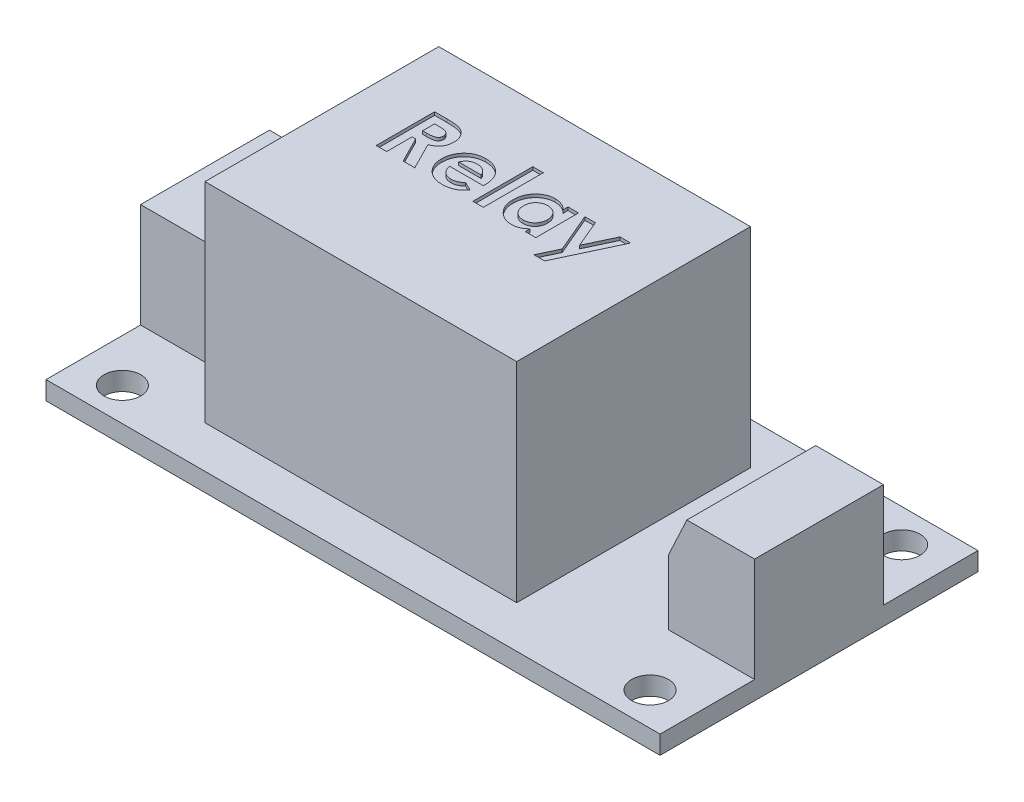
from build123d import *
from OCP.BRepFilletAPI import BRepFilletAPI_MakeChamfer

# Parameters (mm, degrees)
SKETCH1_W           = 50.038
SKETCH1_H           = 25.908
BOSS_EXTRUDE1_DEPTH = 1.5
SKETCH2_W           = 25.4
SKETCH2_H           = 19.05
BOSS_EXTRUDE2_DEPTH = 17.018
SKETCH3_W           = 6.99999997
SKETCH3_H           = 10.5
BOSS_EXTRUDE3_DEPTH = 8.5
CHAMFER1_SIZE       = 3.175
CHAMFER1_SIZE2      = 1.480526815
SKETCH4_W           = 0.854807692
SKETCH4_H           = 4.884615385
CUT_EXTRUDE1_DEPTH  = 0.254
SKETCH6_R           = 1.5
CUT_EXTRUDE2_DEPTH  = 34.714578519


with BuildPart() as part:
    # Sketch1 → Boss-Extrude1 (new body)
    with BuildSketch(Plane(origin=(0, 0, 0), x_dir=(1, 0, 0), z_dir=(0, 1, 0))):
        Rectangle(SKETCH1_W, SKETCH1_H)
    extrude(amount=BOSS_EXTRUDE1_DEPTH)

    # Sketch2 → Boss-Extrude2 (add)
    with BuildSketch(Plane(origin=(0, 1.5, 0), x_dir=(1, 0, 0), z_dir=(0, 1, 0))):
        with Locations((-2.794, 0)):
            Rectangle(SKETCH2_W, SKETCH2_H)
    extrude(amount=BOSS_EXTRUDE2_DEPTH)

    # Sketch3 → Boss-Extrude3 (add)
    with BuildSketch(Plane(origin=(0, 1.5, 0), x_dir=(1, 0, 0), z_dir=(0, 1, 0))):
        with Locations((-21.519000015, 0)):
            Rectangle(SKETCH3_W, SKETCH3_H)
        with Locations((21.519000015, 0)):
            Rectangle(SKETCH3_W, SKETCH3_H)
    extrude(amount=BOSS_EXTRUDE3_DEPTH)

    # Chamfer1: one chamfer whose edges measure the first distance from different faces: ONE call of the kernel's chamfer builder (chamfer() names one face for all edges)
    chamfer1_edges_1 = [part.edges().sort_by_distance(p)[0] for p in [
        (-18.01900003, 10, 0),
    ]]
    chamfer1_side_1 = [part.faces().sort_by_distance(p)[0] for p in [
        (-18.01900003, 5.75, 0),
    ]]
    chamfer1_edges_2 = [part.edges().sort_by_distance(p)[0] for p in [
        (18.01900003, 10, 0),
    ]]
    chamfer1_side_2 = [part.faces().sort_by_distance(p)[0] for p in [
        (18.01900003, 5.75, 0),
    ]]
    chamfer1 = BRepFilletAPI_MakeChamfer(part.part.solid().wrapped)
    for e in chamfer1_edges_1:
        chamfer1.Add(CHAMFER1_SIZE, CHAMFER1_SIZE2, e.wrapped, chamfer1_side_1[0].wrapped)  # the first distance lies on this face
    for e in chamfer1_edges_2:
        chamfer1.Add(CHAMFER1_SIZE, CHAMFER1_SIZE2, e.wrapped, chamfer1_side_2[0].wrapped)  # the first distance lies on this face
    add(Compound.cast(chamfer1.Shape()), mode=Mode.REPLACE)

    # Sketch4 → Cut-Extrude1 (cut)
    # profile 1 of 5: a face of its own
    with BuildSketch(Plane(origin=(0, 18.518, 0), x_dir=(1, 0, 0), z_dir=(0, 1, 0))):
        with BuildLine():
            Line((-11.067317308, 4.7625), (-10.071313702, 4.7625))
            add(Edge.make_bspline(
                [(-10.071313702, 4.7625), (-10.005478167, 4.762266322), (-9.878857888, 4.761816892), (-9.696278361, 4.754726088), (-9.528553957, 4.744858652), (-9.375436345, 4.729800683), (-9.236991031, 4.709835636), (-9.113079259, 4.686300149), (-9.003704652, 4.659476416), (-8.907944787, 4.626051928), (-8.821526244, 4.588349612), (-8.740972147, 4.545028961), (-8.664505354, 4.496572362), (-8.592636962, 4.441704791), (-8.524742417, 4.381413304), (-8.460693634, 4.315637209), (-8.40139568, 4.243818754), (-8.347215731, 4.166411739), (-8.297835069, 4.084981335), (-8.25419292, 3.999415736), (-8.218703053, 3.909655438), (-8.18734395, 3.816997671), (-8.164757004, 3.720117874), (-8.149048114, 3.619959188), (-8.137546679, 3.516169044), (-8.136885402, 3.445658629), (-8.136548077, 3.409690505)],
                knots=[0, 0, 0, 0, 1.749336639, 3.364467119, 4.854658419, 6.213483162, 7.451590619, 8.570285859, 9.5643256, 10.440900261, 11.26203566, 12.067320669, 12.869050712, 13.665104639, 14.467235401, 15.27997916, 16.102287765, 16.939272006, 17.78853747, 18.631303466, 19.488103222, 20.351255419, 21.228522269, 22.127379805, 23.044756219, 24, 24, 24, 24], degree=3))
            add(Edge.make_bspline(
                [(-8.136548077, 3.409690505), (-8.137424325, 3.372148046), (-8.139142489, 3.298534126), (-8.148397453, 3.190401282), (-8.165312621, 3.08694734), (-8.190933103, 2.988475202), (-8.220380519, 2.893759265), (-8.259538028, 2.804547099), (-8.303731148, 2.719541242), (-8.356218026, 2.639944134), (-8.413819809, 2.563987763), (-8.480809472, 2.494582302), (-8.552847113, 2.427997468), (-8.633982229, 2.368403909), (-8.720638311, 2.311772125), (-8.814537122, 2.260448648), (-8.915065847, 2.213143322), (-8.98574252, 2.186762605), (-9.021884615, 2.173272236)],
                knots=[0, 0, 0, 0, 1.099860209, 2.156625411, 3.176576793, 4.16617041, 5.135385252, 6.078461593, 7.016046972, 7.938469504, 8.868247731, 9.803980173, 10.76021508, 11.73834243, 12.748633912, 13.790971185, 14.870363756, 16, 16, 16, 16], degree=3))
            Line((-9.021884615, 2.173272236), (-7.922846154, 0))
            Line((-7.922846154, 0), (-8.87305649, 0))
            Line((-8.87305649, 0), (-9.922485577, 2.075961538))
            Line((-9.922485577, 2.075961538), (-10.212509615, 2.075961538))
            Line((-10.212509615, 2.075961538), (-10.212509615, 0))
            Line((-10.212509615, 0), (-11.067317308, 0))
            Line((-11.067317308, 0), (-11.067317308, 4.7625))
        make_face()
        with BuildLine():
            Line((-10.212509615, 2.930769231), (-9.879554387, 2.930769231))
            add(Edge.make_bspline(
                [(-9.879554387, 2.930769231), (-9.838847843, 2.931227695), (-9.760903557, 2.932105556), (-9.648809437, 2.936177439), (-9.547001243, 2.945988665), (-9.455041776, 2.958384782), (-9.372468305, 2.972697889), (-9.300017355, 2.993209441), (-9.236572569, 3.015188087), (-9.182885769, 3.042501844), (-9.137017001, 3.07356351), (-9.097412256, 3.108850334), (-9.064653453, 3.14969034), (-9.037691287, 3.194973672), (-9.016717653, 3.24510085), (-9.001408507, 3.299521593), (-8.992852959, 3.358855821), (-8.991868614, 3.399804517), (-8.991355769, 3.421138822)],
                knots=[0, 0, 0, 0, 1.688639943, 3.233382647, 4.650958383, 5.928841754, 7.082724185, 8.122798841, 9.049171256, 9.863274652, 10.613301712, 11.341792392, 12.054588806, 12.776240173, 13.521029143, 14.301969904, 15.115324896, 16, 16, 16, 16], degree=3))
            add(Edge.make_bspline(
                [(-8.991355769, 3.421138822), (-8.992325349, 3.446378863), (-8.994229908, 3.495958245), (-9.013129056, 3.567335171), (-9.043212417, 3.633399399), (-9.084448465, 3.693852436), (-9.136379907, 3.746849741), (-9.195975333, 3.793567287), (-9.264520958, 3.830508027), (-9.327989048, 3.854873746), (-9.385730175, 3.869452007), (-9.43783972, 3.880315598), (-9.498182887, 3.888014937), (-9.566805232, 3.896181456), (-9.643531834, 3.90147703), (-9.728780899, 3.905341744), (-9.822307592, 3.906922988), (-9.88750458, 3.907428484), (-9.92153155, 3.907692308)],
                knots=[0, 0, 0, 0, 1.020303359, 2.004196876, 2.966617323, 3.9489082, 4.950758222, 5.960522915, 7.003732012, 8.091992268, 8.70421221, 9.413913587, 10.24622431, 11.166358409, 12.212345909, 13.359657661, 14.621978493, 16, 16, 16, 16], degree=3))
            Line((-9.92153155, 3.907692308), (-10.212509615, 3.907692308))
            Line((-10.212509615, 3.907692308), (-10.212509615, 2.930769231))
        make_face(mode=Mode.SUBTRACT)
    # profile 2 of 5: a face of its own
    with BuildSketch(Plane(origin=(0, 18.518, 0), x_dir=(1, 0, 0), z_dir=(0, 1, 0))):
        with BuildLine():
            Line((-3.865371695, 1.526442308), (-6.610105769, 1.526442308))
            add(Edge.make_bspline(
                [(-6.610105769, 1.526442308), (-6.604509478, 1.494550055), (-6.593512324, 1.431879262), (-6.569631614, 1.340844497), (-6.539156247, 1.255054871), (-6.502633438, 1.174395705), (-6.460678962, 1.098440584), (-6.411742542, 1.027545769), (-6.356444891, 0.961773878), (-6.295105726, 0.901410762), (-6.228747459, 0.847324102), (-6.157691904, 0.799940769), (-6.081865735, 0.761089335), (-6.002138271, 0.728341607), (-5.917913765, 0.702402089), (-5.829068258, 0.684512097), (-5.735837268, 0.673944413), (-5.672325469, 0.672415918), (-5.639860877, 0.671634615)],
                knots=[0, 0, 0, 0, 1.091296461, 2.144483647, 3.168565212, 4.157007626, 5.126487748, 6.090021542, 7.05641414, 8.019231907, 8.98705074, 9.938580405, 10.892824166, 11.854447369, 12.841318655, 13.858982407, 14.905600794, 16, 16, 16, 16], degree=3))
            add(Edge.make_bspline(
                [(-5.639860877, 0.671634615), (-5.600673911, 0.672669189), (-5.523503235, 0.67470657), (-5.410447619, 0.692775108), (-5.30110637, 0.720066841), (-5.196514241, 0.760651938), (-5.095459697, 0.81117325), (-4.999606405, 0.874116589), (-4.907295221, 0.947642543), (-4.850974521, 1.004316321), (-4.822260216, 1.033210637)],
                knots=[0, 0, 0, 0, 1.021034703, 2.010718019, 2.977989445, 3.954245119, 4.929443971, 5.918328161, 6.938689359, 8, 8, 8, 8], degree=3))
            Line((-4.822260216, 1.033210637), (-4.106740385, 0.692623197))
            add(Edge.make_bspline(
                [(-4.106740385, 0.692623197), (-4.129268109, 0.66149334), (-4.173905966, 0.599810672), (-4.24677577, 0.513007227), (-4.322820051, 0.432016092), (-4.402095521, 0.357369958), (-4.484702723, 0.289281535), (-4.570411864, 0.226921385), (-4.660475546, 0.171963853), (-4.753092963, 0.121750125), (-4.850178689, 0.078702129), (-4.951464044, 0.041992318), (-5.056520029, 0.008806961), (-5.166673272, -0.016478463), (-5.28100653, -0.036494199), (-5.399793309, -0.050708023), (-5.523017955, -0.059487221), (-5.606773028, -0.060527984), (-5.649401142, -0.061057692)],
                knots=[0, 0, 0, 0, 1.028154879, 2.037251081, 3.030720504, 4.000128189, 4.949298328, 5.894184978, 6.834267904, 7.770992897, 8.712077017, 9.673380525, 10.653304757, 11.658697181, 12.695551717, 13.758623199, 14.859225354, 16, 16, 16, 16], degree=3))
            add(Edge.make_bspline(
                [(-5.649401142, -0.061057692), (-5.714983794, -0.059720659), (-5.843423639, -0.057102157), (-6.031290131, -0.032798711), (-6.209711191, 0.007499023), (-6.379190619, 0.062277602), (-6.538995812, 0.134602488), (-6.689205857, 0.223061824), (-6.831321568, 0.325959665), (-6.961000516, 0.445455566), (-7.079141864, 0.575519749), (-7.182909878, 0.715199801), (-7.269741475, 0.863519828), (-7.341049328, 1.019498219), (-7.396472269, 1.183534217), (-7.436428995, 1.355699403), (-7.460922946, 1.535911549), (-7.463568415, 1.658656137), (-7.464913462, 1.721063702)],
                knots=[0, 0, 0, 0, 1.103565453, 2.161269334, 3.182010356, 4.179077853, 5.15417608, 6.128274628, 7.109042802, 8.101804412, 9.090965879, 10.063106201, 11.02526161, 11.978650795, 12.945248442, 13.93468508, 14.949922959, 16, 16, 16, 16], degree=3))
            add(Edge.make_bspline(
                [(-7.464913462, 1.721063702), (-7.463555176, 1.785057123), (-7.460882812, 1.910961304), (-7.436639887, 2.095334631), (-7.396361802, 2.271251722), (-7.340776737, 2.438954834), (-7.270550632, 2.598968471), (-7.182614253, 2.749892704), (-7.079193358, 2.892252971), (-6.961477612, 3.025383294), (-6.831249304, 3.145547956), (-6.692869423, 3.252638683), (-6.544783129, 3.341873786), (-6.388665406, 3.413975693), (-6.225514839, 3.472556673), (-6.053445636, 3.511537423), (-5.87376698, 3.537710663), (-5.750942608, 3.540121055), (-5.688516226, 3.541346154)],
                knots=[0, 0, 0, 0, 1.079208495, 2.12329425, 3.130605359, 4.119693003, 5.099659317, 6.073216462, 7.060498243, 8.06384408, 9.066070512, 10.045757761, 11.010926815, 11.975797609, 12.942977511, 13.929384301, 14.947594487, 16, 16, 16, 16], degree=3))
            add(Edge.make_bspline(
                [(-5.688516226, 3.541346154), (-5.622619388, 3.539988378), (-5.493237738, 3.537322524), (-5.304062814, 3.513216417), (-5.124457059, 3.472672952), (-4.953655253, 3.418368033), (-4.793838603, 3.344216144), (-4.641495455, 3.257933653), (-4.50027986, 3.152811596), (-4.36868661, 3.03390047), (-4.249896808, 2.901972697), (-4.146061359, 2.758658728), (-4.057710172, 2.605357225), (-3.986100658, 2.441446516), (-3.930734626, 2.267418679), (-3.890740914, 2.083499721), (-3.866433793, 1.888990104), (-3.86383755, 1.755798222), (-3.862509615, 1.687672776)],
                knots=[0, 0, 0, 0, 1.080001299, 2.120471247, 3.119684163, 4.095710327, 5.052285597, 6.002875087, 6.961153713, 7.931888285, 8.906493152, 9.865905668, 10.82813294, 11.801621613, 12.7925306, 13.817193356, 14.883530496, 16, 16, 16, 16], degree=3))
            Line((-3.862509615, 1.687672776), (-3.865371695, 1.526442308))
        make_face()
        with BuildLine():
            add(Edge.make_bspline(
                [(-4.717317308, 2.198076923), (-4.733448052, 2.241607267), (-4.765520173, 2.32815693), (-4.837969759, 2.447574346), (-4.934108043, 2.550994679), (-5.045923764, 2.64255352), (-5.173680226, 2.716868394), (-5.3133516, 2.770674777), (-5.463172467, 2.802937758), (-5.56624115, 2.806721639), (-5.618872296, 2.808653846)],
                knots=[0, 0, 0, 0, 0.954238005, 1.897273737, 2.851915805, 3.847685534, 4.862635127, 5.880135777, 6.917509367, 8, 8, 8, 8], degree=3))
            add(Edge.make_bspline(
                [(-5.618872296, 2.808653846), (-5.676354076, 2.806797726), (-5.788718989, 2.803169399), (-5.950797725, 2.764580803), (-6.103682541, 2.706988476), (-6.193814763, 2.647609565), (-6.238989483, 2.617848558)],
                knots=[0, 0, 0, 0, 1.044195649, 2.041185066, 3.018232172, 4, 4, 4, 4], degree=3))
            add(Edge.make_bspline(
                [(-6.238989483, 2.617848558), (-6.267175135, 2.595181923), (-6.327265503, 2.546857816), (-6.405305036, 2.450455811), (-6.482174627, 2.333734623), (-6.525879227, 2.245076635), (-6.549048077, 2.198076923)],
                knots=[0, 0, 0, 0, 0.82159062, 1.751589201, 2.808063854, 4, 4, 4, 4], degree=3))
            Line((-6.549048077, 2.198076923), (-4.717317308, 2.198076923))
        make_face(mode=Mode.SUBTRACT)
    # profile 3 of 5: a face of its own
    with BuildSketch(Plane(origin=(0, 18.518, 0), x_dir=(1, 0, 0), z_dir=(0, 1, 0))):
        with Locations((-2.763471154, 2.442307693)):
            Rectangle(SKETCH4_W, SKETCH4_H)
    # profile 4 of 5: a face of its own
    with BuildSketch(Plane(origin=(0, 18.518, 0), x_dir=(1, 0, 0), z_dir=(0, 1, 0))):
        with BuildLine():
            Line((1.083163462, 3.480288462), (1.937971154, 3.480288462))
            Line((1.937971154, 3.480288462), (1.937971154, 0))
            Line((1.937971154, 0), (1.083163462, 0))
            Line((1.083163462, 0), (1.083163462, 0.379702524))
            add(Edge.make_bspline(
                [(1.083163462, 0.379702524), (1.040808055, 0.342742686), (0.958604576, 0.271010939), (0.829078493, 0.177937173), (0.699173919, 0.101163345), (0.56826666, 0.040017178), (0.434344726, -0.005132973), (0.296443933, -0.037822737), (0.152578363, -0.057100691), (0.05478053, -0.059724952), (0.005113582, -0.061057692)],
                knots=[0, 0, 0, 0, 1.129196829, 2.191548051, 3.199897424, 4.157751732, 5.089409408, 6.034969131, 7.002052659, 8, 8, 8, 8], degree=3))
            add(Edge.make_bspline(
                [(0.005113582, -0.061057692), (-0.050639776, -0.059803416), (-0.16081157, -0.057324895), (-0.322476448, -0.031234465), (-0.478579959, 0.008702754), (-0.628995391, 0.06521891), (-0.773449078, 0.138452769), (-0.913046527, 0.226493557), (-1.045394614, 0.332432032), (-1.171595091, 0.451684506), (-1.28714349, 0.582863076), (-1.388156991, 0.724147001), (-1.473303866, 0.873532482), (-1.543060144, 1.030524235), (-1.597932464, 1.195007039), (-1.637048577, 1.367502582), (-1.660127129, 1.548072471), (-1.662983603, 1.671069608), (-1.664432692, 1.733466046)],
                knots=[0, 0, 0, 0, 0.980476535, 1.937477201, 2.874147792, 3.812856188, 4.758993464, 5.720109578, 6.712210464, 7.737600662, 8.772720504, 9.783789959, 10.789002326, 11.793715968, 12.802552247, 13.835794126, 14.902098527, 16, 16, 16, 16], degree=3))
            add(Edge.make_bspline(
                [(-1.664432692, 1.733466046), (-1.662911868, 1.798077639), (-1.659928601, 1.92482048), (-1.638106182, 2.110809571), (-1.599711909, 2.287582127), (-1.547358557, 2.455383002), (-1.480015061, 2.614241187), (-1.397995182, 2.76441694), (-1.300183118, 2.905517729), (-1.187472053, 3.035141917), (-1.065771786, 3.153948746), (-0.935574015, 3.257379512), (-0.798914748, 3.345248761), (-0.655648761, 3.416984168), (-0.505796514, 3.472417659), (-0.34994962, 3.512944068), (-0.187416229, 3.537261337), (-0.076697166, 3.53997324), (-0.020645132, 3.541346154)],
                knots=[0, 0, 0, 0, 1.136281865, 2.228943489, 3.287578264, 4.313574083, 5.316051562, 6.317280042, 7.318008486, 8.329309503, 9.333984563, 10.305318864, 11.248632312, 12.186624717, 13.117503092, 14.05354244, 15.014596925, 16, 16, 16, 16], degree=3))
            add(Edge.make_bspline(
                [(-0.020645132, 3.541346154), (0.031277213, 3.540267456), (0.134012819, 3.538133103), (0.285019358, 3.514958106), (0.431473921, 3.479907569), (0.572577591, 3.429966863), (0.709487748, 3.366906562), (0.83984945, 3.287887304), (0.966514477, 3.196230234), (1.043800059, 3.12464412), (1.083163462, 3.088183594)],
                knots=[0, 0, 0, 0, 1.017011718, 2.012299608, 2.98747302, 3.965332399, 4.941441765, 5.936729654, 6.94912688, 8, 8, 8, 8], degree=3))
            Line((1.083163462, 3.088183594), (1.083163462, 3.480288462))
        make_face()
        with BuildLine():
            add(Edge.make_bspline(
                [(0.158711839, 2.747596154), (0.124650272, 2.746551027), (0.057891825, 2.744502648), (-0.040285606, 2.732181502), (-0.134113779, 2.710471093), (-0.222923518, 2.678398627), (-0.308038414, 2.63932969), (-0.388165984, 2.590396489), (-0.463967546, 2.532558486), (-0.534997302, 2.467215937), (-0.59975139, 2.39539253), (-0.655573193, 2.31701763), (-0.703012707, 2.234202997), (-0.743134207, 2.146699635), (-0.771852098, 2.05347211), (-0.794596656, 1.955734077), (-0.806399609, 1.852687068), (-0.808539112, 1.78246372), (-0.809625, 1.746822416)],
                knots=[0, 0, 0, 0, 1.04836806, 2.054732945, 3.03993516, 4.00574415, 4.955904794, 5.917688631, 6.888591924, 7.88601754, 8.884115178, 9.859153345, 10.841239365, 11.818093293, 12.814750328, 13.83810466, 14.90274714, 16, 16, 16, 16], degree=3))
            add(Edge.make_bspline(
                [(-0.809625, 1.746822416), (-0.808555699, 1.710857825), (-0.806448655, 1.639990014), (-0.794405813, 1.536073766), (-0.772479699, 1.436908011), (-0.740490324, 1.343294435), (-0.701423877, 1.253969882), (-0.653871226, 1.169346594), (-0.595461123, 1.090920816), (-0.530650271, 1.016836731), (-0.458163351, 0.950682518), (-0.381932874, 0.891943651), (-0.300917591, 0.842796878), (-0.215996462, 0.803076146), (-0.127455334, 0.770707088), (-0.03418417, 0.749269534), (0.06290332, 0.735564913), (0.129090426, 0.733656455), (0.162527945, 0.732692308)],
                knots=[0, 0, 0, 0, 1.099136573, 2.165835871, 3.191374663, 4.196217796, 5.183857741, 6.167377911, 7.154730987, 8.166690795, 9.170734848, 10.148332609, 11.103258353, 12.059567475, 13.009337315, 13.978056681, 14.978520572, 16, 16, 16, 16], degree=3))
            add(Edge.make_bspline(
                [(0.162527945, 0.732692308), (0.197223948, 0.733743293), (0.265246976, 0.735803797), (0.365026123, 0.748012499), (0.460114744, 0.769802511), (0.550117221, 0.802058599), (0.636408255, 0.840847098), (0.718209148, 0.888824107), (0.794632235, 0.946529388), (0.866064566, 1.012462635), (0.931518527, 1.084872524), (0.988112301, 1.164275186), (1.037407549, 1.248131105), (1.076175994, 1.338422942), (1.106963576, 1.433571011), (1.129052955, 1.53416582), (1.141068297, 1.640315823), (1.143156914, 1.712767336), (1.144221154, 1.749684495)],
                knots=[0, 0, 0, 0, 1.050008698, 2.058587853, 3.036635738, 3.995319155, 4.947022481, 5.895997462, 6.858296291, 7.838991643, 8.833936038, 9.806048392, 10.784806122, 11.771666913, 12.772873988, 13.80724452, 14.882696879, 16, 16, 16, 16], degree=3))
            add(Edge.make_bspline(
                [(1.144221154, 1.749684495), (1.143170138, 1.785966696), (1.141117199, 1.856836375), (1.129001136, 1.960770016), (1.106754935, 2.059389602), (1.076601012, 2.15287641), (1.037142865, 2.241016681), (0.987810319, 2.322833151), (0.931837345, 2.401160454), (0.865658715, 2.471614152), (0.794613349, 2.537069991), (0.717066336, 2.593030223), (0.635460828, 2.641258303), (0.549295438, 2.680855416), (0.457772314, 2.709881602), (0.362521193, 2.732355515), (0.262055957, 2.744495253), (0.193722031, 2.746545652), (0.158711839, 2.747596154)],
                knots=[0, 0, 0, 0, 1.106611376, 2.161533483, 3.185006901, 4.184773755, 5.152708835, 6.122342771, 7.094156588, 8.082475533, 9.064254463, 10.03606828, 10.992420271, 11.951521816, 12.920622147, 13.915721683, 14.932141191, 16, 16, 16, 16], degree=3))
        make_face(mode=Mode.SUBTRACT)
    # profile 5 of 5: a face of its own
    with BuildSketch(Plane(origin=(0, 18.518, 0), x_dir=(1, 0, 0), z_dir=(0, 1, 0))):
        Polygon((2.455053486, 3.480288462), (3.310815204, 3.480288462), (4.261025541, 1.241188401), (5.31236268, 3.480288462), (6.181480769, 3.480288462), (3.944288762, -1.282211538), (3.075170673, -1.282211538), (3.81072506, 0.283345853), align=None)
    extrude(amount=-CUT_EXTRUDE1_DEPTH, mode=Mode.SUBTRACT)

    # Sketch6 → Cut-Extrude2 (cut, through all)
    with BuildSketch(Plane.XZ):
        with Locations(Location((21.5, -10.25, 0), (0, 0, 270))):
            Circle(SKETCH6_R)
        with Locations(Location((-21.5, -10.25, 0), (0, 0, 270))):
            Circle(SKETCH6_R)
        with Locations(Location((-21.5, 10.25, 0), (0, 0, 270))):
            Circle(SKETCH6_R)
        with Locations(Location((21.5, 10.25, 0), (0, 0, 270))):
            Circle(SKETCH6_R)
    extrude(amount=-CUT_EXTRUDE2_DEPTH, mode=Mode.SUBTRACT)


solid = part.part
